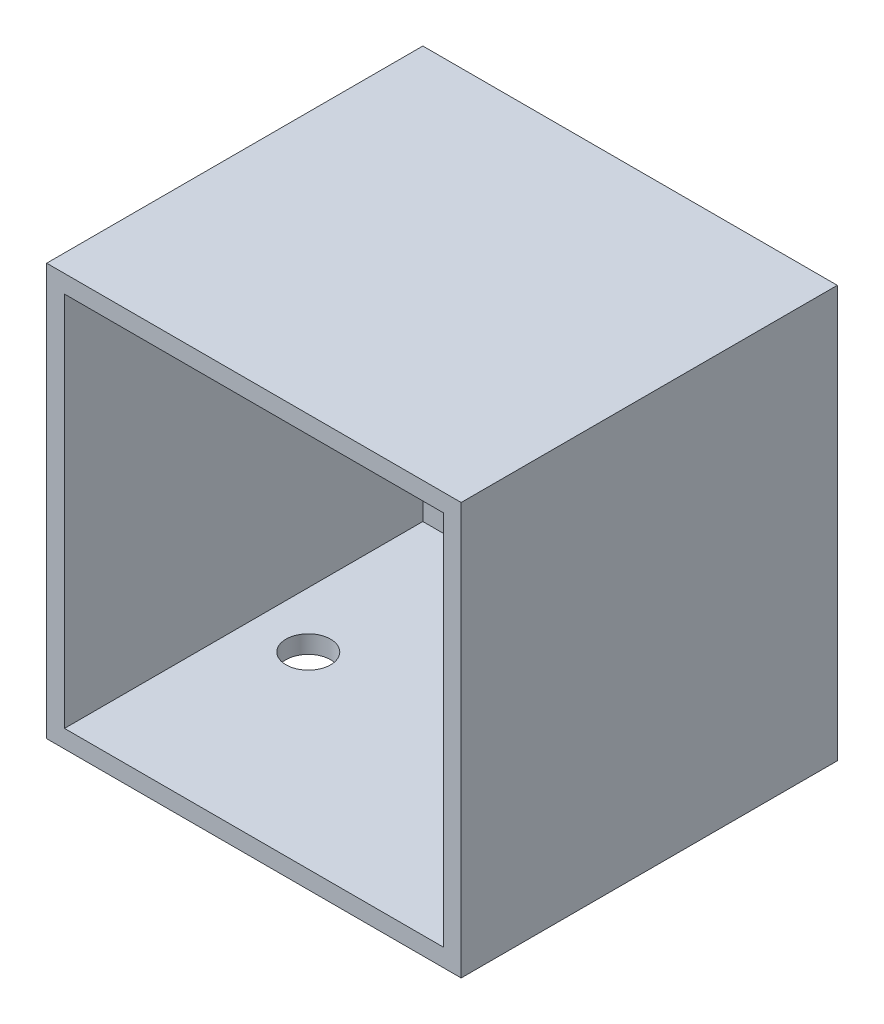
from build123d import *

# Parameters (mm, degrees)
SKETCH2_W           = 46.5
SKETCH2_H           = 42.2
SKETCH2_R           = 2.5
BOSS_EXTRUDE1_DEPTH = 2
BOSS_EXTRUDE2_DEPTH = 42.2
SKETCH4_W           = 46.5
SKETCH4_H           = 42.2
BOSS_EXTRUDE3_DEPTH = 2


with BuildPart() as part:
    # Sketch2 → Boss-Extrude1 (new body)
    with BuildSketch(Plane(origin=(0, 0, 0), x_dir=(1, 0, 0), z_dir=(0, 1, 0))):
        Rectangle(SKETCH2_W, SKETCH2_H)
        with Locations(Location((-15, 0, 0), (0, 0, 270))):
            Circle(SKETCH2_R, mode=Mode.SUBTRACT)
        with Locations(Location((15, 0, 0), (0, 0, 90))):
            Circle(SKETCH2_R, mode=Mode.SUBTRACT)
    extrude(amount=BOSS_EXTRUDE1_DEPTH)

    # Sketch3 → Boss-Extrude2 (add)
    with BuildSketch(Plane(origin=(0, 2, 0), x_dir=(1, 0, 0), z_dir=(0, 1, 0))):
        Polygon((-23.25, -21.1), (-21.25, -21.1), (-21.25, 19.1), (21.25, 19.1), (21.25, -21.1), (23.25, -21.1), (23.25, 21.1), (-23.25, 21.1), align=None)
    extrude(amount=BOSS_EXTRUDE2_DEPTH)

    # Sketch4 → Boss-Extrude3 (add)
    with BuildSketch(Plane(origin=(0, 44.2, 0), x_dir=(1, 0, 0), z_dir=(0, 1, 0))):
        Rectangle(SKETCH4_W, SKETCH4_H)
    extrude(amount=BOSS_EXTRUDE3_DEPTH)


solid = part.part
